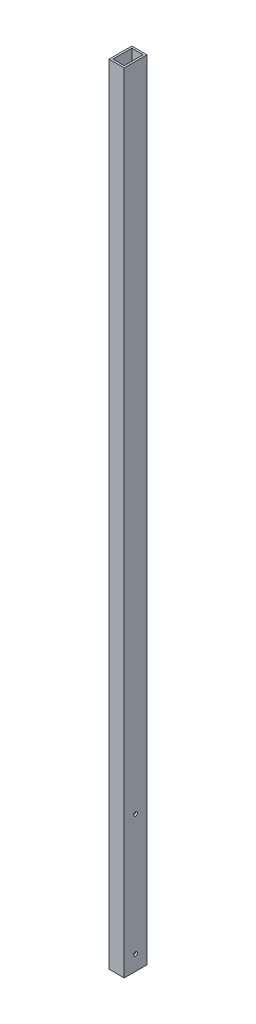
from build123d import *

# Parameters (mm, degrees)
SKETCH1_W           = 25.4
SKETCH1_H           = 38.1
SKETCH1_W_2         = 19.05
SKETCH1_H_2         = 31.75
BOSS_EXTRUDE1_DEPTH = 1320.8
SKETCH2_R           = 3.175
CUT_EXTRUDE1_DEPTH  = 3.175


with BuildPart() as part:
    # Sketch1 → Boss-Extrude1 (new body)
    with BuildSketch(Plane(origin=(0, 0, 0), x_dir=(1, 0, 0), z_dir=(0, 1, 0))):
        Rectangle(SKETCH1_W, SKETCH1_H)
        Rectangle(SKETCH1_W_2, SKETCH1_H_2, mode=Mode.SUBTRACT)
    extrude(amount=BOSS_EXTRUDE1_DEPTH)

    # Sketch2 → Cut-Extrude1 (cut)
    with BuildSketch(Plane.ZY.offset(12.7)):
        with Locations((0, 25.4)):
            Circle(SKETCH2_R)
        with Locations((0, 228.6)):
            Circle(SKETCH2_R)
    cut_extrude1 = extrude(amount=-CUT_EXTRUDE1_DEPTH, mode=Mode.SUBTRACT)

    # Mirror1: Cut-Extrude1 across plane
    add(cut_extrude1.mirror(Plane(origin=(0, 0, 0), x_dir=(0, 0, 1), z_dir=(1, 0, 0))), mode=Mode.SUBTRACT)


solid = part.part
